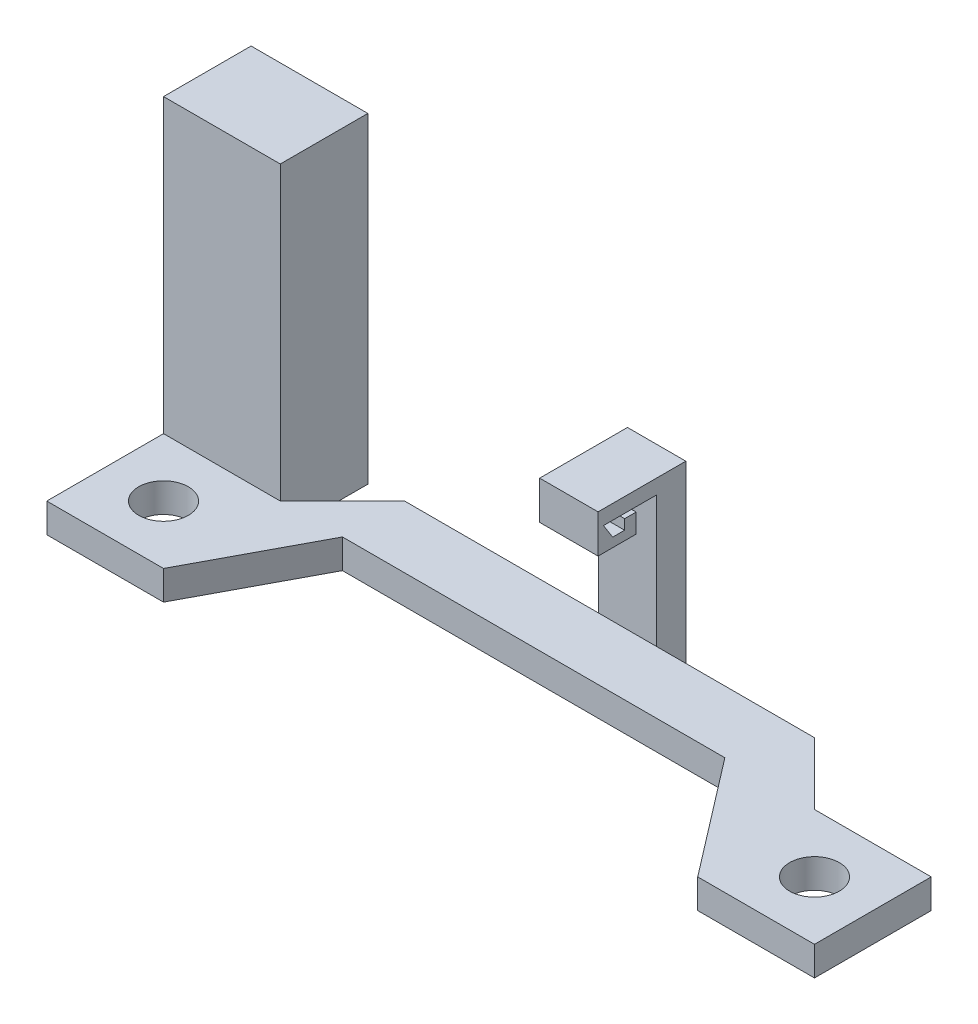
from build123d import *

# Parameters (mm, degrees)
SKETCH1_R                = 2.159
BOSS_EXTRUDE2_DEPTH      = 2.54
BOSS_EXTRUDE5_DEPTH      = 25.4
BOSS_EXTRUDE5_DEPTH_BACK = 2.54
BOSS_EXTRUDE8_DEPTH      = 12.7
BOSS_EXTRUDE8_DEPTH_BACK = 2.54
SKETCH4_W                = 5.08
SKETCH4_H                = 2.54
BOSS_EXTRUDE9_DEPTH      = 5.08


with BuildPart() as part:
    # Sketch1 → Boss-Extrude2 (new body)
    with BuildSketch(Plane(origin=(0, 0, 0), x_dir=(1, 0, 0), z_dir=(0, 1, 0))):
        Polygon((0, -5.08), (5.08, -5.08), (10.489221848, 5.08), (43.764184298, 5.08), (51.562, -5.08), (61.722, -5.08), (61.722, 5.08), (56.642, 5.08), (51.562, 5.08), (46.152778152, 10.489221848), (10.489221848, 10.489221848), (5.08, 5.08), (-5.08, 5.08), (-5.08, -5.08), align=None)
        Circle(SKETCH1_R, mode=Mode.SUBTRACT)
        with Locations((56.642, 0)):
            Circle(SKETCH1_R, mode=Mode.SUBTRACT)
    extrude(amount=BOSS_EXTRUDE2_DEPTH)

    # Sketch3 → Boss-Extrude5 (add, two sides: drawn at the far end of the back side and taken through both)
    with BuildSketch(Plane(origin=(0, 2.54, 0), x_dir=(1, 0, 0), z_dir=(0, 1, 0)).offset(-BOSS_EXTRUDE5_DEPTH_BACK)):
        Polygon((-5.08, 5.08), (5.08, 5.08), (5.08, 12.7), (0, 12.7), (-5.08, 12.7), align=None)
    extrude(amount=BOSS_EXTRUDE5_DEPTH + BOSS_EXTRUDE5_DEPTH_BACK)

    # Sketch4 → Boss-Extrude8 (add, two sides: drawn at the far end of the back side and taken through both)
    with BuildSketch(Plane(origin=(0, 2.54, 0), x_dir=(1, 0, 0), z_dir=(0, 1, 0)).offset(-BOSS_EXTRUDE8_DEPTH_BACK)):
        with Locations((29.878652905, 11.759221848)):
            Rectangle(SKETCH4_W, SKETCH4_H)
    extrude(amount=BOSS_EXTRUDE8_DEPTH + BOSS_EXTRUDE8_DEPTH_BACK)

    # Sketch7 → Boss-Extrude9 (add)
    with BuildSketch(Plane(origin=(32.418652905, 0, 0), x_dir=(0, 0, -1), z_dir=(1, 0, 0))):
        Polygon((10.489221848, 15.24), (5.391589044, 15.24), (5.391589044, 12.7), (5.391589044, 11.903510412), (7.271896049, 11.903510412), (8.703373283, 11.903510412), (8.703373283, 13.570272135), (7.703807283, 13.570272135), (7.703807283, 12.7), (7.271896049, 12.7), (6.661589044, 12.7), (5.865099456, 13.97), (6.661589044, 13.97), (10.489221848, 13.97), align=None)
    extrude(amount=-BOSS_EXTRUDE9_DEPTH)


solid = part.part
